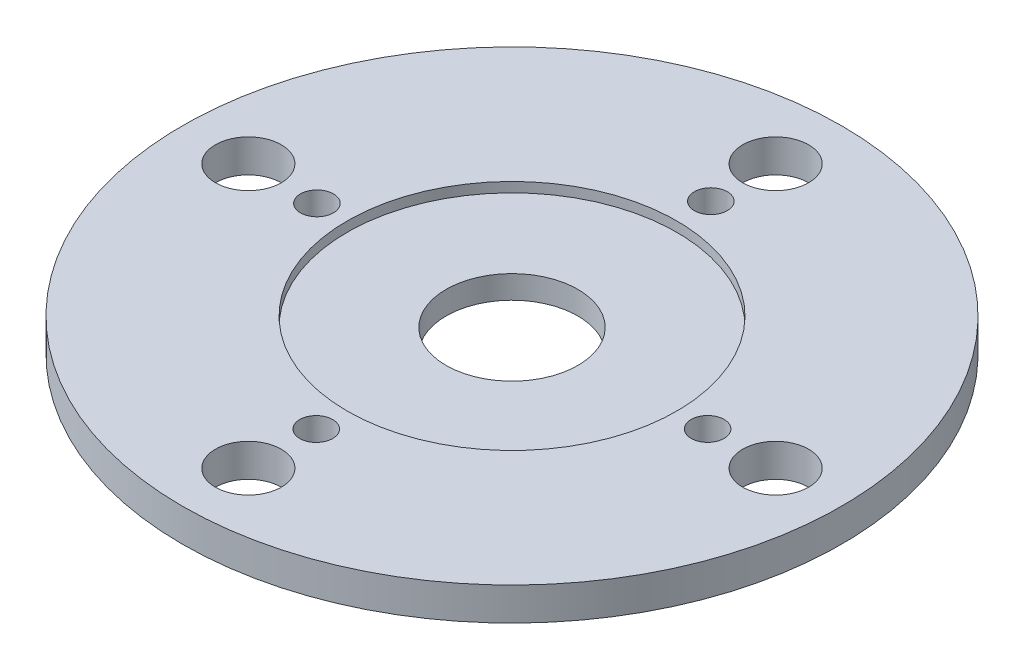
from build123d import *

# Parameters (mm, degrees)
SKETCH1_R           = 10
SKETCH1_R_2         = 2
SKETCH1_R_3         = 1
SKETCH1_R_4         = 0.5
BOSS_EXTRUDE1_DEPTH = 1
SKETCH2_R           = 5
CUT_EXTRUDE1_DEPTH  = 0.3


with BuildPart() as part:
    # Sketch1 → Boss-Extrude1 (new body)
    with BuildSketch(Plane(origin=(0, 0, 0), x_dir=(1, 0, 0), z_dir=(0, 1, 0))):
        with Locations(Location((0, 0, 0), (0, 0, 270))):
            Circle(SKETCH1_R)
        with Locations(Location((0, 0, 0), (0, 0, 270))):
            Circle(SKETCH1_R_2, mode=Mode.SUBTRACT)
        with Locations(Location((-8, 0, 0), (0, 0, 270))):
            Circle(SKETCH1_R_3, mode=Mode.SUBTRACT)
        with Locations(Location((-5.919172613, 0, 0), (0, 0, 270))):
            Circle(SKETCH1_R_4, mode=Mode.SUBTRACT)
        with Locations(Location((0, -5.941415712, 0), (0, 0, 90))):
            Circle(SKETCH1_R_4, mode=Mode.SUBTRACT)
        with Locations(Location((0, -8, 0), (0, 0, 90))):
            Circle(SKETCH1_R_3, mode=Mode.SUBTRACT)
        with Locations(Location((5.936823246, 0, 0), (0, 0, 90))):
            Circle(SKETCH1_R_4, mode=Mode.SUBTRACT)
        with Locations(Location((8, 0, 0), (0, 0, 90))):
            Circle(SKETCH1_R_3, mode=Mode.SUBTRACT)
        with Locations(Location((0, 6.0333524, 0), (0, 0, 270))):
            Circle(SKETCH1_R_4, mode=Mode.SUBTRACT)
        with Locations(Location((0, 8, 0), (0, 0, 270))):
            Circle(SKETCH1_R_3, mode=Mode.SUBTRACT)
    extrude(amount=BOSS_EXTRUDE1_DEPTH)

    # Sketch2 → Cut-Extrude1 (cut)
    with BuildSketch(Plane(origin=(0, 1, 0), x_dir=(1, 0, 0), z_dir=(0, 1, 0))):
        with Locations(Location((0, 0, 0), (0, 0, 270))):
            Circle(SKETCH2_R)
    extrude(amount=-CUT_EXTRUDE1_DEPTH, mode=Mode.SUBTRACT)


solid = part.part
